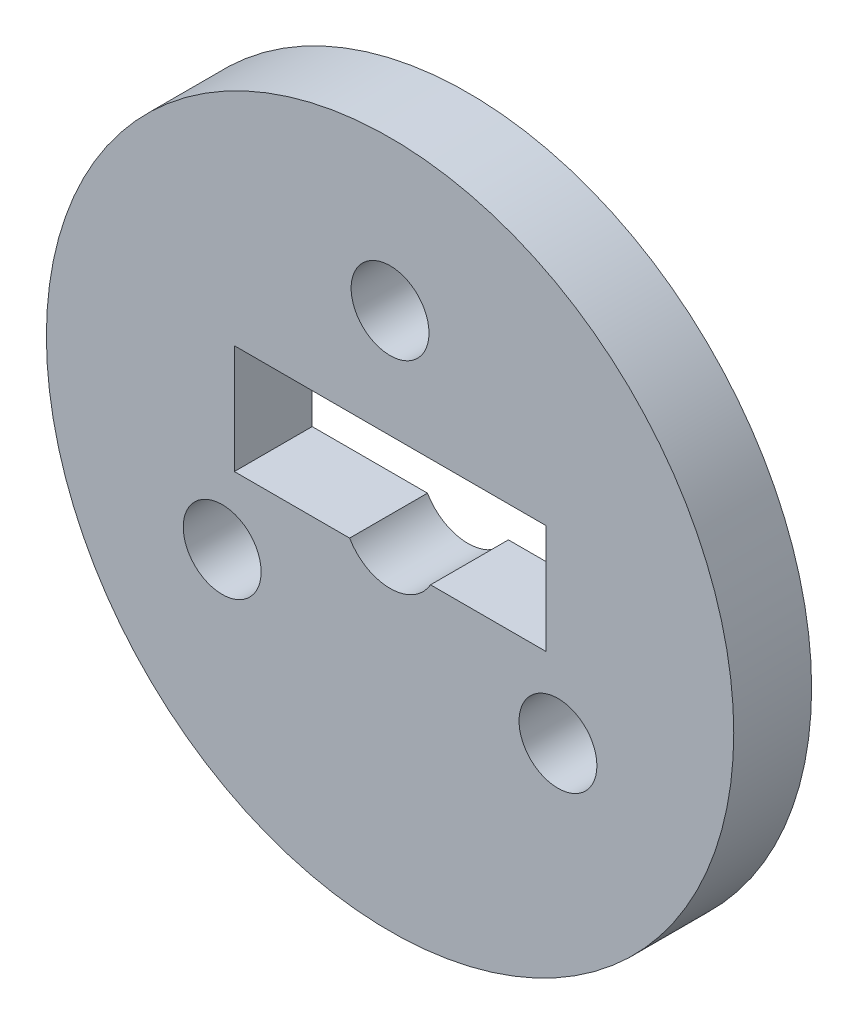
from build123d import *

# Parameters (mm, degrees)
SKETCH_1_R      = 22.071639064
SKETCH_1_R_2    = 2.5
EXTRUDE_1_DEPTH = 5


with BuildPart() as part:
    # 스케치1 → 보스-돌출1 (new body)
    with BuildSketch(Plane.XY):
        Circle(SKETCH_1_R)
        with Locations((0, 12.45)):
            Circle(SKETCH_1_R_2, mode=Mode.SUBTRACT)
        with Locations((-10.782016277, -6.225)):
            Circle(SKETCH_1_R_2, mode=Mode.SUBTRACT)
        with Locations((10.782016277, -6.225)):
            Circle(SKETCH_1_R_2, mode=Mode.SUBTRACT)
        with BuildLine():
            Line((10, 5.5), (10, -1.5))
            Line((10, -1.5), (2.598076211, -1.5))
            ThreePointArc((2.598076211, -1.5), (0, -3), (-2.598076211, -1.5))
            Line((-2.598076211, -1.5), (-10, -1.5))
            Line((-10, -1.5), (-10, 5.5))
            Line((-10, 5.5), (10, 5.5))
        make_face(mode=Mode.SUBTRACT)
    extrude(amount=EXTRUDE_1_DEPTH)


solid = part.part
